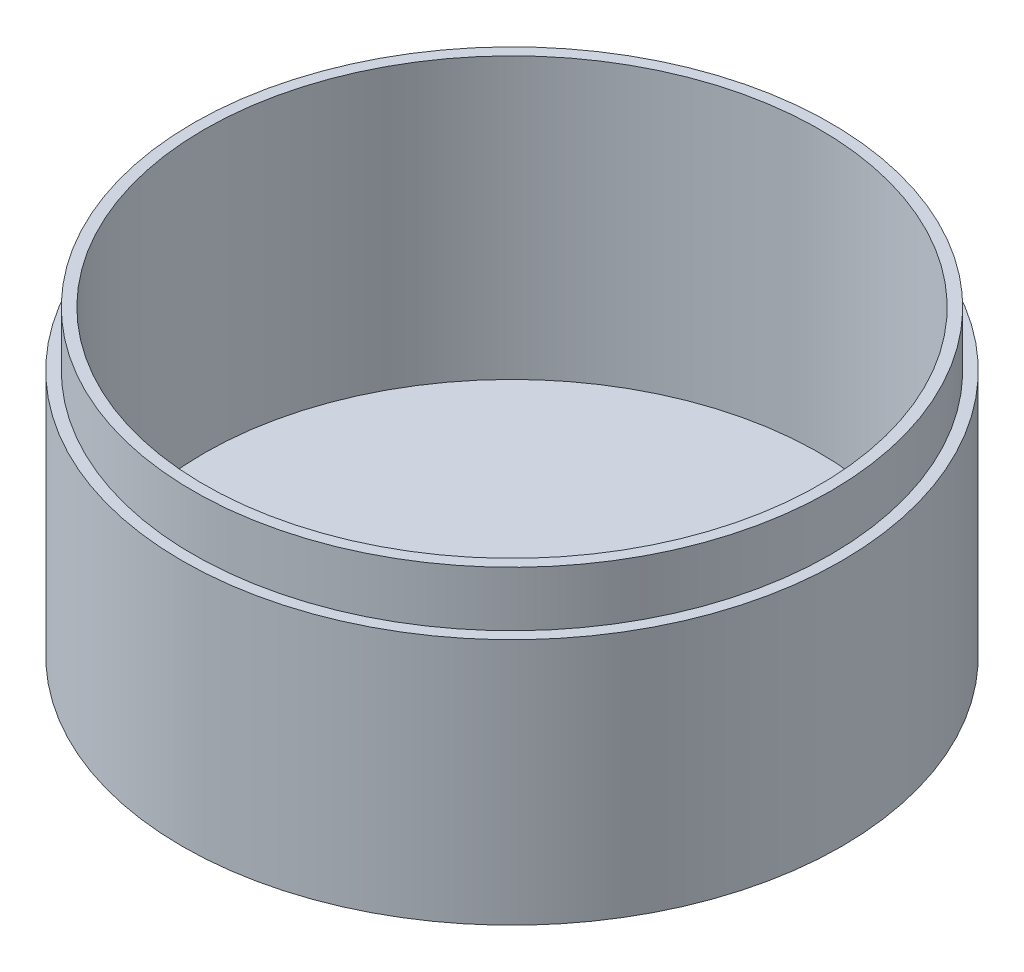
from build123d import *


with BuildPart() as part:
    # Sketch1 → Revolve1 (revolve)
    with BuildSketch(Plane.XY, mode=Mode.PRIVATE) as revolve1_sk:
        Polygon((0, 0), (76.2, 0), (76.2, 57.15), (73.66, 57.15), (73.66, 69.85), (71.12, 69.85), (71.12, 5.08), (0, 5.08), align=None)
    revolve(revolve1_sk.sketch.rotate(Axis((0, 5.08, 0), (0, -1, 0)), 180), axis=Axis((0, 5.08, 0), (0, -1, 0)))


solid = part.part
